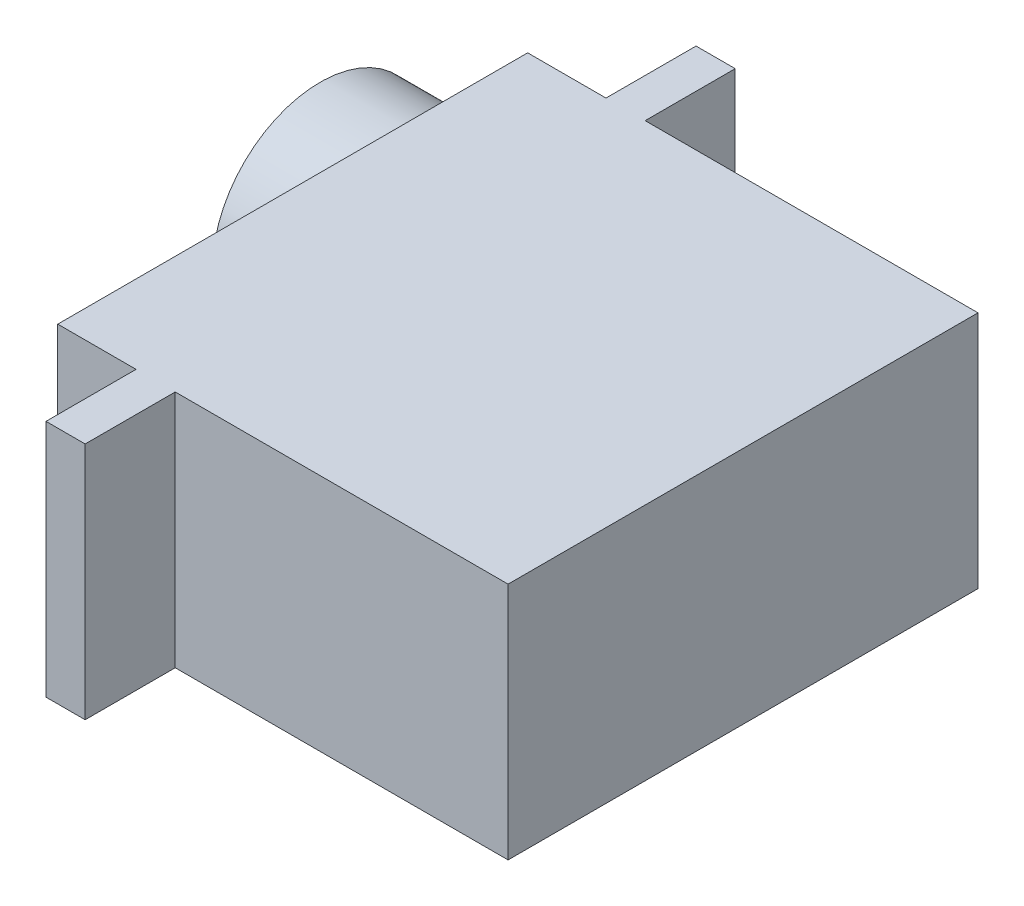
from build123d import *

# Parameters (mm, degrees)
SKETCH_1_W           = 23
SKETCH_1_H           = 12.2
EXTRUDE_1_DEPTH      = 24
EXTRUDE_2_DEPTH      = 4.6
EXTRUDE_2_DEPTH_BACK = 28.6
SKETCH_2_W           = 2
SKETCH_2_H           = 12.2
SKETCH_3_R           = 5.5
EXTRUDE_3_DEPTH      = 4.6


with BuildPart() as part:
    # 草图1 → 凸台-拉伸1 (new body)
    with BuildSketch(Plane.XY):
        with Locations((11.5, 6.1)):
            Rectangle(SKETCH_1_W, SKETCH_1_H)
    extrude(amount=EXTRUDE_1_DEPTH)

    # 草图2 → 凸台-拉伸2 (add, two sides: drawn at the far end of the back side and taken through both)
    with BuildSketch(Plane.XY.offset(24).offset(-EXTRUDE_2_DEPTH_BACK)):
        with Locations((5, 6.1)):
            Rectangle(SKETCH_2_W, SKETCH_2_H)
    extrude(amount=EXTRUDE_2_DEPTH + EXTRUDE_2_DEPTH_BACK)

    # 草图3 → 凸台-拉伸3 (add)
    with BuildSketch(Plane.ZY):
        with Locations((6, 6.1)):
            Circle(SKETCH_3_R)
    extrude(amount=EXTRUDE_3_DEPTH)


solid = part.part
